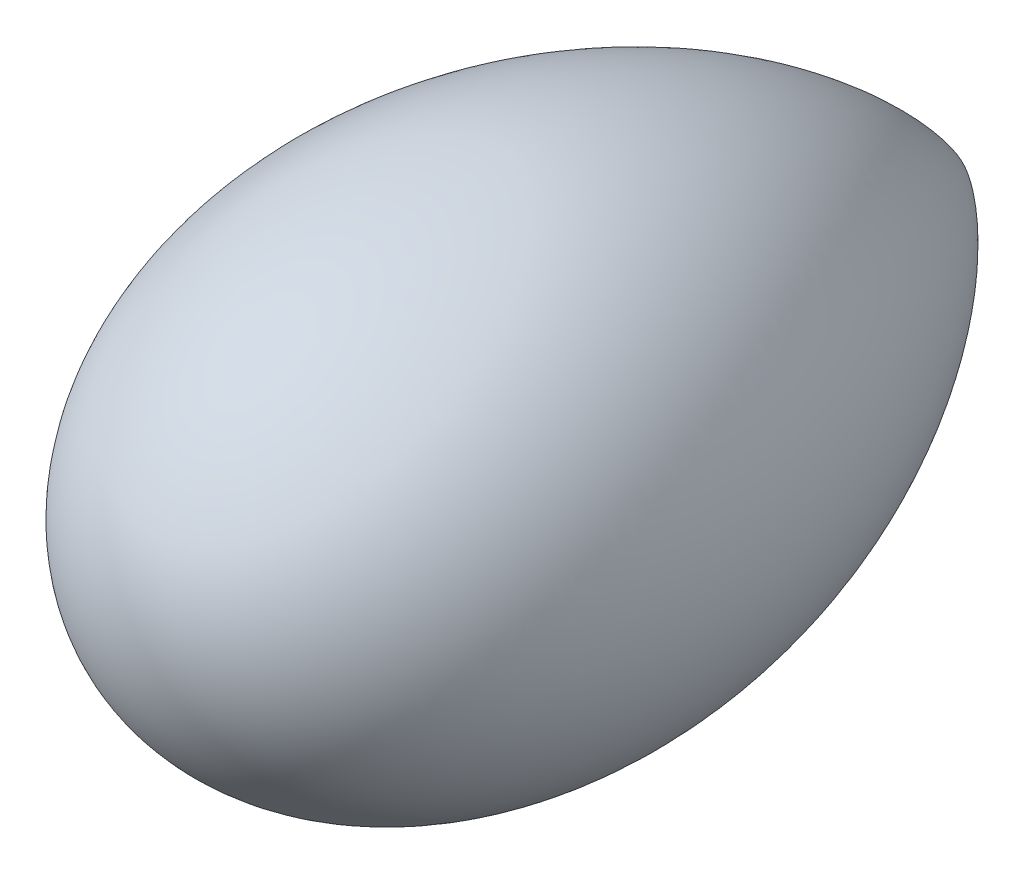
from build123d import *


with BuildPart() as part:
    # Sketch1 → Revolve1 (revolve)
    with BuildSketch(Plane(origin=(0, 0, 0), x_dir=(1, 0, 0), z_dir=(0, 1, 0))):
        with BuildLine():
            Line((0, -111.462600137), (0, 0))
            add(Edge.make_bspline(
                [(0, -111.462600137), (0.119663796, -111.462600137), (0.359418155, -111.460806703), (0.81339655, -111.45273625), (1.291992107, -111.431224934), (1.771797815, -111.403012927), (2.154181462, -111.372142779), (2.547428621, -111.335936553), (2.937132141, -111.294405219), (3.391737162, -111.238212732), (4.039162414, -111.144742729), (4.812896196, -111.011600029), (5.709918124, -110.826003495), (6.979787665, -110.509904393), (8.482046329, -110.050755162), (9.952102864, -109.495427919), (11.622567491, -108.741947994), (13.244100136, -107.88829683), (14.812825258, -106.940056905), (16.527756962, -105.737112094), (18.160781062, -104.425339585), (19.70916547, -103.014848365), (21.171272092, -101.515265025), (22.546338682, -99.935637178), (24.15633982, -97.871543064), (25.740736775, -95.525217308), (27.262287651, -92.889568701), (28.591568146, -90.153265379), (29.569546837, -87.833011283), (30.548800182, -85.178785686), (31.483293181, -82.179369064), (32.358859866, -78.619288625), (33.259013204, -73.460281424), (33.804251806, -67.194607831), (33.713113872, -59.853090753), (32.691974675, -51.526896486), (30.819203229, -43.35157409), (28.146837326, -35.402483016), (24.714889743, -27.750786046), (21.071980261, -21.380607593), (17.501826196, -16.206310495), (14.227166512, -12.120988045), (11.775498973, -9.396392704), (9.55698811, -7.172623555), (7.769195383, -5.535490477), (6.473394064, -4.423260798), (5.037991946, -3.263931226), (3.82810989, -2.357343588), (2.700895246, -1.576104484), (1.661345226, -0.917684938), (1.090594344, -0.577144214), (0.593460457, -0.298966802), (0.256786726, -0.123170174), (0.086004181, -0.04022852), (0, 0)],
                knots=[0.085324672, 0.085324672, 0.085324672, 0.085324672, 0.085324672, 0.088748551, 0.09217243, 0.09559631, 0.099020189, 0.100732129, 0.102444068, 0.105867948, 0.109291827, 0.112715706, 0.119563473, 0.12641124, 0.133259006, 0.146954545, 0.16065009, 0.167497862, 0.181193346, 0.194888829, 0.208584416, 0.222280002, 0.235975531, 0.24967106, 0.26336662, 0.277062181, 0.30445317, 0.323693004, 0.342932838, 0.356628382, 0.370323926, 0.397715015, 0.425106105, 0.452497194, 0.507279374, 0.562061568, 0.616843749, 0.67162593, 0.726408051, 0.781190345, 0.83597255, 0.863363609, 0.890754668, 0.918145814, 0.931841387, 0.94553696, 0.954183705, 0.96283045, 0.98012394, 0.985092955, 0.99006197, 0.995030985, 0.997515492, 1, 1, 1, 1, 1], degree=4))
        make_face()
    revolve(axis=Axis((0, 0, 0), (0, 0, 1)))


solid = part.part
